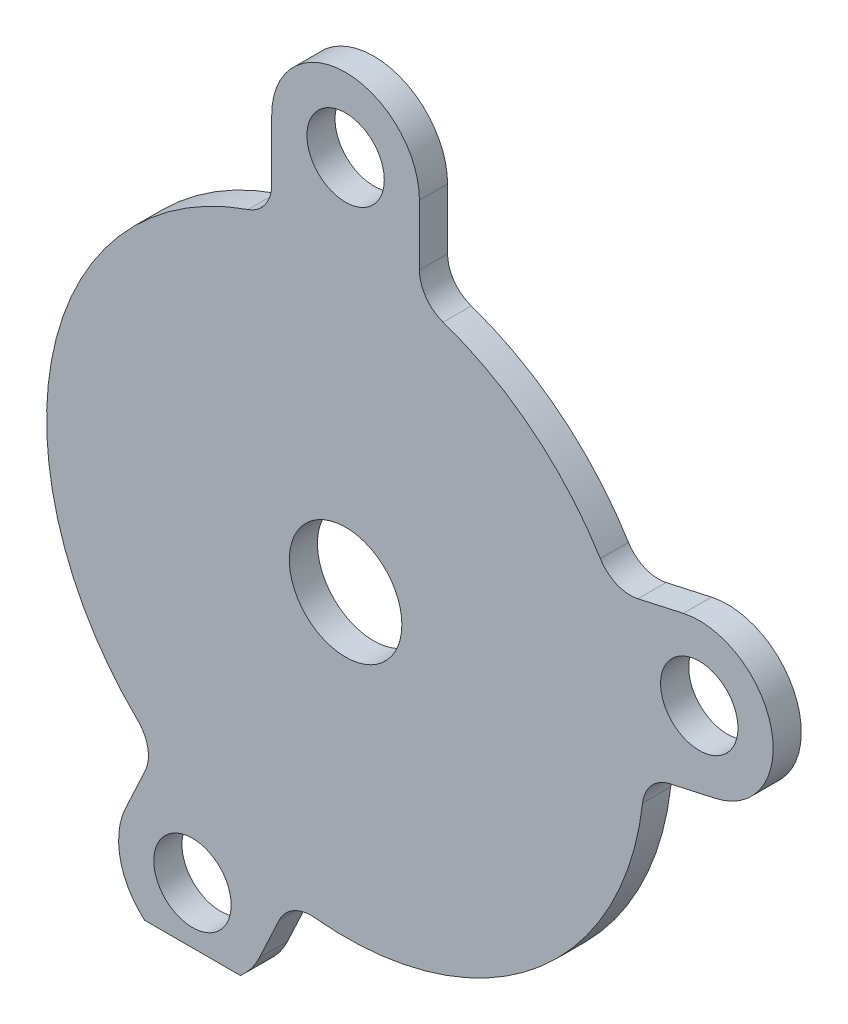
from build123d import *

# Parameters (mm, degrees)
SKETCH1_R           = 5.5
SKETCH1_R_2         = 8
BOSS_EXTRUDE1_DEPTH = 4


with BuildPart() as part:
    # Sketch1 → Boss-Extrude1 (new body)
    with BuildSketch(Plane.XY):
        with BuildLine():
            Line((-31.281072244, -42.237359284), (-28.491744654, -36.255626964))
            ThreePointArc((-28.491744654, -36.255626964), (-28.106649146, -33.233302048), (-29.547148474, -30.548584534))
            ThreePointArc((-29.547148474, -30.548584534), (-41.492580303, 9.198683592), (-13.868421053, 40.173584574))
            ThreePointArc((-13.868421053, 40.173584574), (-11.428274645, 41.997983641), (-10.5, 44.899888641))
            Line((-10.5, 44.899888641), (-10.5, 53.5))
            ThreePointArc((-10.5, 53.5), (0, 64), (10.5, 53.5))
            Line((10.5, 53.5), (10.5, 44.899888641))
            ThreePointArc((10.5, 44.899888641), (11.428274645, 41.997983641), (13.868421053, 40.173584574))
            ThreePointArc((13.868421053, 40.173584574), (26.601747568, 33.145090531), (36.219634513, 22.234839234))
            ThreePointArc((36.219634513, 22.234839234), (38.528932384, 20.247406269), (41.562966054, 19.969222638))
            Line((41.562966054, 19.969222638), (48.00662842, 21.397748193))
            ThreePointArc((48.00662842, 21.397748193), (60.530352441, 13.419256064), (52.551860313, 0.895532043))
            Line((52.551860313, 0.895532043), (46.108197947, -0.532993511))
            ThreePointArc((46.108197947, -0.532993511), (43.475995088, -2.067351539), (42.22298591, -4.844528963))
            ThreePointArc((42.22298591, -4.844528963), (26.601747568, -33.145090531), (-4.409032487, -42.270680531))
            ThreePointArc((-4.409032487, -42.270680531), (-7.39158054, -42.892897179), (-9.459281126, -45.130610461))
            Line((-9.459281126, -45.130610461), (-12.248608716, -51.112342781))
            ThreePointArc((-12.248608716, -51.112342781), (-13.414168685, -53.040091057), (-14.964105225, -54.674851032))
            Line((-14.964105225, -54.674851032), (-28.565575734, -54.674851032))
            ThreePointArc((-28.565575734, -54.674851032), (-32.023186029, -48.914571235), (-31.281072244, -42.237359284))
        make_face()
        with Locations((50.279244367, 11.146640118)):
            Circle(SKETCH1_R, mode=Mode.SUBTRACT)
        with Locations((0, 53.5)):
            Circle(SKETCH1_R, mode=Mode.SUBTRACT)
        with Locations((-21.76484048, -46.674851032)):
            Circle(SKETCH1_R, mode=Mode.SUBTRACT)
        Circle(SKETCH1_R_2, mode=Mode.SUBTRACT)
    extrude(amount=BOSS_EXTRUDE1_DEPTH)


solid = part.part
